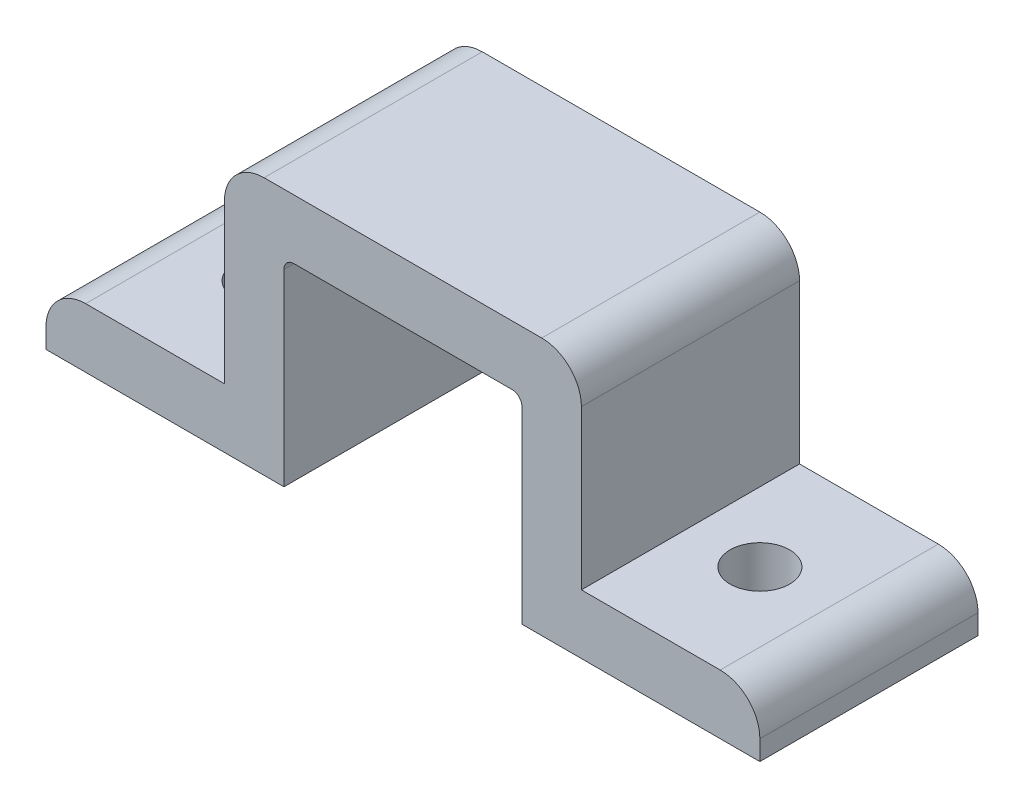
from build123d import *

# Parameters (mm, degrees)
BOSS_EXTRUDE1_DEPTH = 11
FILLET1_R           = 2
FILLET2_R           = 0.5
SKETCH2_R           = 1.5
CUT_EXTRUDE1_DEPTH  = 3


with BuildPart() as part:
    # Sketch1 → Boss-Extrude1 (new body)
    with BuildSketch(Plane.XY):
        Polygon((6, 10), (-6, 10), (-6, 0), (-18, 0), (-18, 3), (-9, 3), (-9, 13), (9, 13), (9, 3), (18, 3), (18, 0), (6, 0), align=None)
    extrude(amount=BOSS_EXTRUDE1_DEPTH)

    # Fillet1
    fillet1_edges = [part.edges().sort_by_distance(p)[0] for p in [
        (-18, 3, 5.5),
        (-9, 13, 5.5),
        (9, 13, 5.5),
        (18, 3, 5.5),
    ]]
    fillet(fillet1_edges, radius=FILLET1_R)

    # Fillet2
    fillet2_edges = [part.edges().sort_by_distance(p)[0] for p in [
        (6, 10, 5.5),
        (-6, 10, 5.5),
    ]]
    fillet(fillet2_edges, radius=FILLET2_R)

    # Sketch2 → Cut-Extrude1 (cut)
    with BuildSketch(Plane(origin=(0, 3, 0), x_dir=(1, 0, 0), z_dir=(0, 1, 0))):
        with Locations(Location((-12.5, -5.5, 0), (0, 0, 270))):
            Circle(SKETCH2_R)
        with Locations(Location((12.5, -5.5, 0), (0, 0, 180))):
            Circle(SKETCH2_R)
    extrude(amount=-CUT_EXTRUDE1_DEPTH, mode=Mode.SUBTRACT)


solid = part.part
